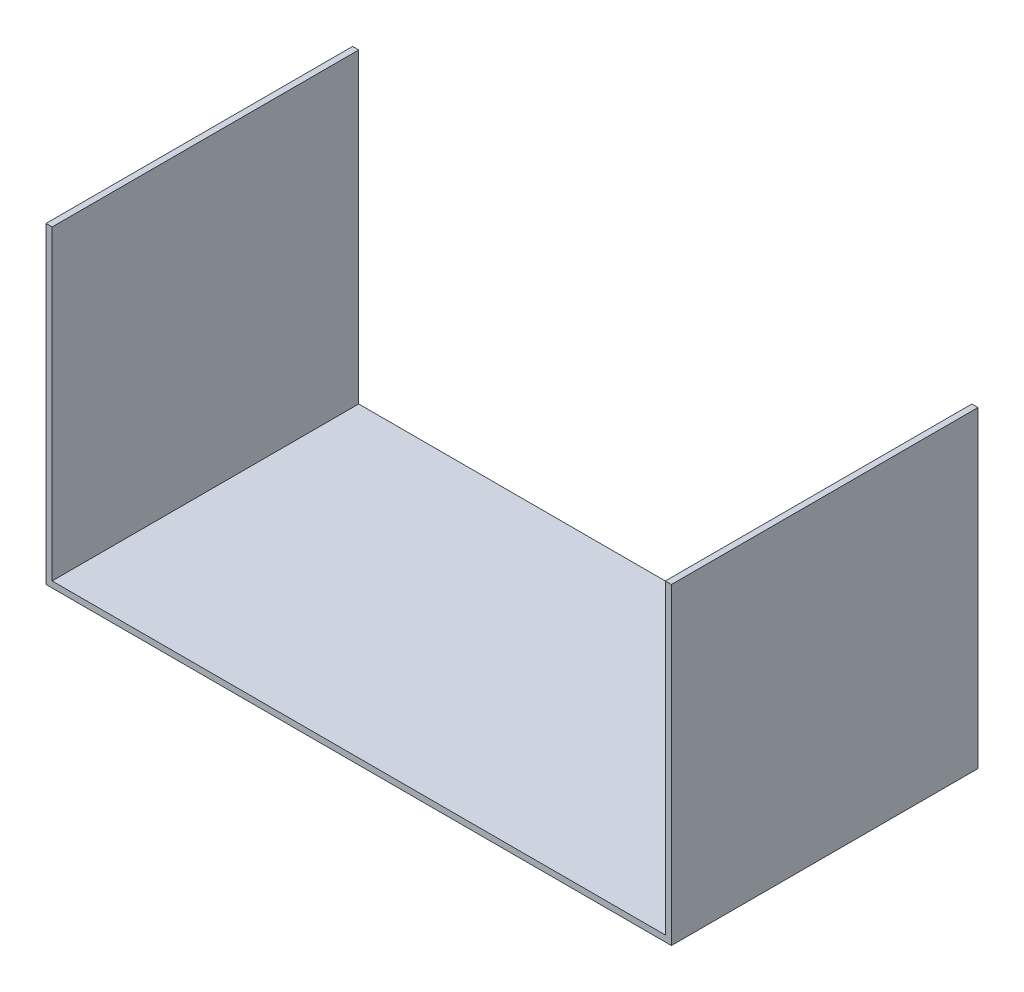
from build123d import *

# Parameters (mm, degrees)
BOSS_EXTRUDE1_DEPTH = 10000


with BuildPart() as part:
    # Sketch2 → Boss-Extrude1 (new body)
    with BuildSketch(Plane.XY):
        Polygon((0, 0), (0, -10000), (20000, -10000), (20000, 0), (20200, 0), (20200, -10200), (-200, -10200), (-200, 0), align=None)
    extrude(amount=BOSS_EXTRUDE1_DEPTH)


solid = part.part
